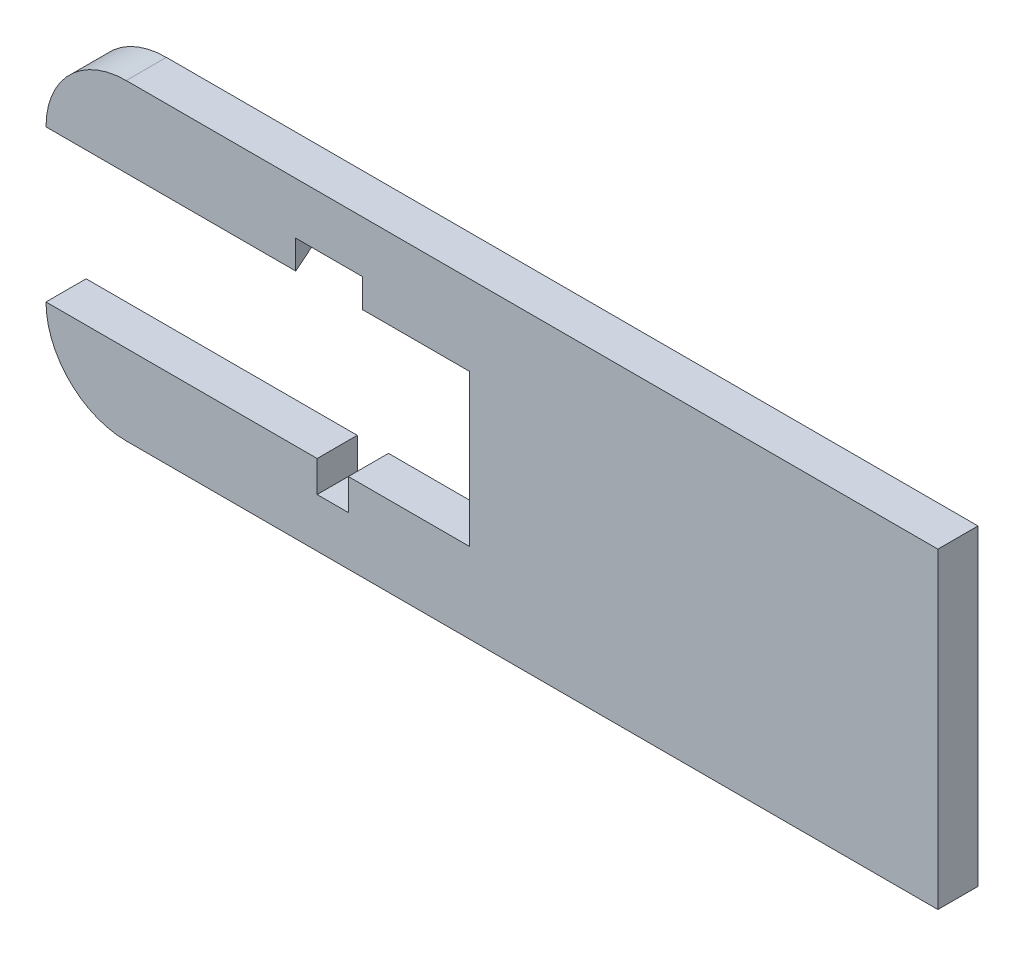
from build123d import *

# Parameters (mm, degrees)
SKETCH1_W           = 254
SKETCH1_H           = 88.9
BOSS_EXTRUDE1_DEPTH = 11.43
FILLET1_R           = 22.86
FILLET2_R           = 22.86
SKETCH2_W           = 11.43
SKETCH2_H           = 43.18
CUT_EXTRUDE1_DEPTH  = 120.65
SKETCH3_W           = 8.89
SKETCH3_H           = 8.89
CUT_EXTRUDE2_DEPTH  = 11.43
SKETCH4_W           = 19.05
SKETCH4_H           = 8.128
CUT_EXTRUDE3_DEPTH  = 11.43
CUT_EXTRUDE4_DEPTH  = 8.128


with BuildPart() as part:
    # Sketch1 → Boss-Extrude1 (new body)
    with BuildSketch(Plane.XY):
        with Locations((127, 44.45)):
            Rectangle(SKETCH1_W, SKETCH1_H)
    extrude(amount=BOSS_EXTRUDE1_DEPTH)

    # Fillet1
    fillet1_edges = [part.edges().sort_by_distance(p)[0] for p in [
        (0, 88.9, 5.715),
    ]]
    fillet(fillet1_edges, radius=FILLET1_R)

    # Fillet2
    fillet2_edges = [part.edges().sort_by_distance(p)[0] for p in [
        (0, 0, 5.715),
    ]]
    fillet(fillet2_edges, radius=FILLET2_R)

    # Sketch2 → Cut-Extrude1 (cut)
    with BuildSketch(Plane.ZY):
        with Locations((5.715, 44.45)):
            Rectangle(SKETCH2_W, SKETCH2_H)
    extrude(amount=-CUT_EXTRUDE1_DEPTH, mode=Mode.SUBTRACT)

    # Sketch3 → Cut-Extrude2 (cut)
    with BuildSketch(Plane.XY.offset(11.43)):
        with Locations((81.661, 18.415)):
            Rectangle(SKETCH3_W, SKETCH3_H)
    extrude(amount=-CUT_EXTRUDE2_DEPTH, mode=Mode.SUBTRACT)

    # Sketch4 → Cut-Extrude3 (cut)
    with BuildSketch(Plane.XY.offset(11.43)):
        with Locations((80.645, 70.104)):
            Rectangle(SKETCH4_W, SKETCH4_H)
    extrude(amount=-CUT_EXTRUDE3_DEPTH, mode=Mode.SUBTRACT)

    # Sketch6 → Cut-Extrude4 (cut)
    with BuildSketch(Plane.XZ.offset(-66.04)):
        Polygon((66.04, 0), (71.12, 11.43), (71.12, 0), align=None)
    extrude(amount=-CUT_EXTRUDE4_DEPTH, mode=Mode.SUBTRACT)


solid = part.part
